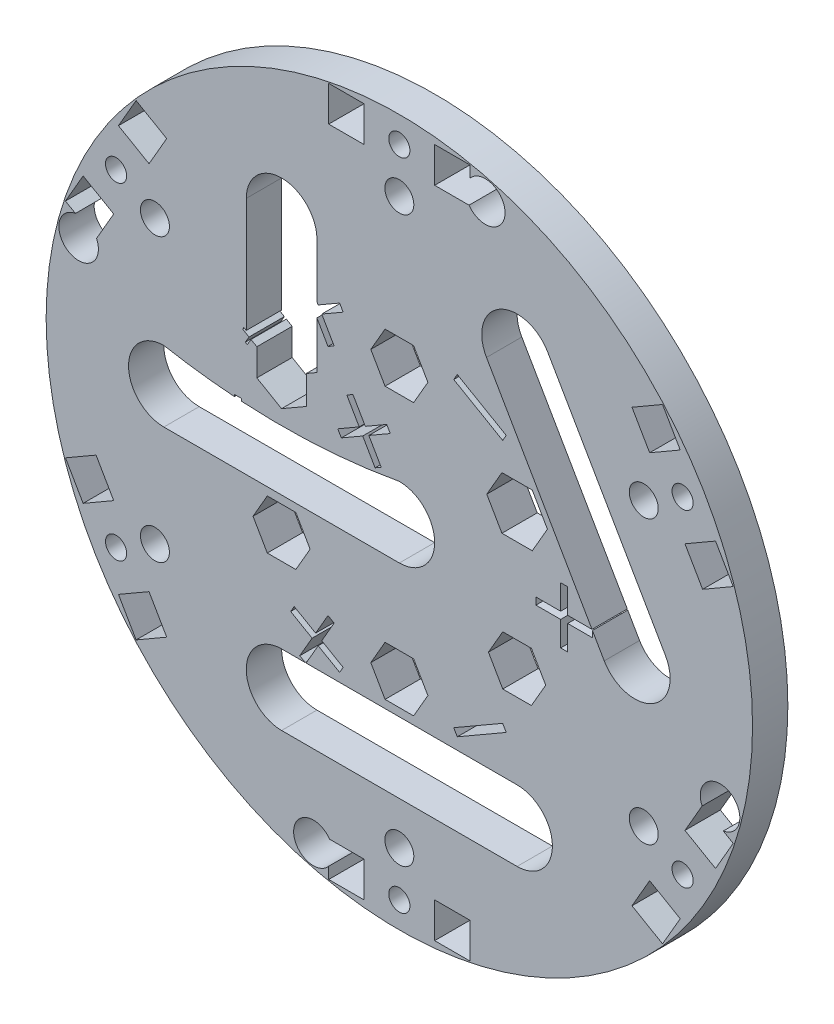
from build123d import *

# Parameters (mm, degrees)
ESQUISSE1_R        = 50
ESQUISSE1_W        = 5
ESQUISSE1_H        = 5
ESQUISSE1_R_2      = 1.5
ESQUISSE1_R_3      = 2.05
BOSS_EXTRU_1_DEPTH = 5
SKETCH3_W          = 1
SKETCH3_H          = 8
CUT_EXTRUDE2_DEPTH = 10
SKETCH4_R          = 2.8
CUT_EXTRUDE4_DEPTH = 10


with BuildPart() as part:
    # Esquisse1 → Boss.-Extru.1 (new body)
    with BuildSketch(Plane.XY):
        Circle(ESQUISSE1_R)
        Polygon((-39.762039705, -28.730127019), (-35.431912686, -26.230127019), (-32.931912686, -30.560254038), (-37.262039705, -33.060254038), align=None, mode=Mode.SUBTRACT)
        with Locations((-7.5, -46.3)):
            Rectangle(ESQUISSE1_W, ESQUISSE1_H, mode=Mode.SUBTRACT)
        with BuildLine():
            ThreePointArc((16.666666667, -23.867513459), (21.666666667, -28.867513459), (16.666666667, -33.867513459))
            Line((16.666666667, -33.867513459), (-16.666666667, -33.867513459))
            ThreePointArc((-16.666666667, -33.867513459), (-21.666666667, -28.867513459), (-16.666666667, -23.867513459))
            Line((-16.666666667, -23.867513459), (16.666666667, -23.867513459))
        make_face(mode=Mode.SUBTRACT)
        with Locations((-40.096976195, -23.15)):
            Circle(ESQUISSE1_R_2, mode=Mode.SUBTRACT)
        Polygon((-42.931912686, -13.239745962), (-40.431912686, -17.569872981), (-44.762039705, -20.069872981), (-47.262039705, -15.739745962), align=None, mode=Mode.SUBTRACT)
        with Locations((-34.597845014, -19.975075133)):
            Circle(ESQUISSE1_R_3, mode=Mode.SUBTRACT)
        Polygon((-14.65067109, -6.125235564), (-12.629945148, -9.625235564), (-14.65067109, -13.125235564), (-18.692122975, -13.125235564), (-20.712848917, -9.625235564), (-18.692122975, -6.125235564), align=None, mode=Mode.SUBTRACT)
        with Locations((0, -46.3)):
            Circle(ESQUISSE1_R_2, mode=Mode.SUBTRACT)
        with Locations((7.5, -46.3)):
            Rectangle(ESQUISSE1_W, ESQUISSE1_H, mode=Mode.SUBTRACT)
        with Locations((0, -39.950150265)):
            Circle(ESQUISSE1_R_3, mode=Mode.SUBTRACT)
        Polygon((32.931912686, -30.560254038), (35.431912686, -26.230127019), (39.762039705, -28.730127019), (37.262039705, -33.060254038), align=None, mode=Mode.SUBTRACT)
        Polygon((-2.020725942, -15.732757636), (2.020725942, -15.732757636), (4.041451884, -19.232757636), (2.020725942, -22.732757636), (-2.020725942, -22.732757636), (-4.041451884, -19.232757636), align=None, mode=Mode.SUBTRACT)
        Polygon((12.613362458, -9.622504487), (14.640014562, -6.112240073), (18.693318771, -6.112240073), (20.719970875, -9.622504487), (18.693318771, -13.132768901), (14.640014562, -13.132768901), align=None, mode=Mode.SUBTRACT)
        with Locations((34.597845014, -19.975075132)):
            Circle(ESQUISSE1_R_3, mode=Mode.SUBTRACT)
        with Locations((40.096976195, -23.15)):
            Circle(ESQUISSE1_R_2, mode=Mode.SUBTRACT)
        Polygon((44.762039705, -20.069872981), (40.431912686, -17.569872981), (42.931912686, -13.239745962), (47.262039705, -15.739745962), align=None, mode=Mode.SUBTRACT)
        Polygon((-44.762039705, 20.069872981), (-40.431912686, 17.569872981), (-42.931912686, 13.239745962), (-47.262039705, 15.739745962), align=None, mode=Mode.SUBTRACT)
        with Locations((-40.096976195, 23.15)):
            Circle(ESQUISSE1_R_2, mode=Mode.SUBTRACT)
        with Locations((-34.597845014, 19.975075133)):
            Circle(ESQUISSE1_R_3, mode=Mode.SUBTRACT)
        with BuildLine():
            Line((0, -5), (-33.333333333, -5))
            ThreePointArc((-33.333333333, -5), (-38.333333333, 0), (-33.333333333, 5))
            ThreePointArc((-33.333333333, 5), (-16.666666667, 3.481507562), (0, 5))
            ThreePointArc((0, 5), (5, 0), (0, -5))
        make_face(mode=Mode.SUBTRACT)
        with BuildLine():
            Line((-20.170900168, 11.646821857), (-21.670687629, 12.511577336))
            Line((-21.670687629, 12.511577336), (-21.666666516, 28.868742619))
            ThreePointArc((-21.666666516, 28.868742619), (-16.665437507, 33.867513308), (-11.666666818, 28.8662843))
            Line((-11.666666818, 28.8662843), (-11.670687326, 12.511578324))
            Line((-11.670687326, 12.511578324), (-13.170900379, 11.645101034))
            Line((-13.170900379, 11.645101034), (-13.171893897, 7.603649272))
            Line((-13.171893897, 7.603649272), (-16.67239055, 5.583783802))
            Line((-16.67239055, 5.583783802), (-20.171893686, 7.605370095))
            Line((-20.171893686, 7.605370095), (-20.170900168, 11.646821857))
        make_face(mode=Mode.SUBTRACT)
        Polygon((-32.931912686, 30.560254038), (-35.431912686, 26.230127019), (-39.762039705, 28.730127019), (-37.262039705, 33.060254038), align=None, mode=Mode.SUBTRACT)
        with Locations((0, 39.950150265)):
            Circle(ESQUISSE1_R_3, mode=Mode.SUBTRACT)
        with Locations((-7.5, 46.3)):
            Rectangle(ESQUISSE1_W, ESQUISSE1_H, mode=Mode.SUBTRACT)
        Polygon((18.816438469, 13.342663918), (20.963305142, 9.624181764), (18.816438469, 5.905699609), (14.522705123, 5.905699609), (12.37583845, 9.624181764), (14.522705123, 13.342663918), align=None, mode=Mode.SUBTRACT)
        Polygon((2.020725942, 22.665334425), (4.041451884, 19.165334425), (2.020725942, 15.665334425), (-2.020725942, 15.665334425), (-4.041451884, 19.165334425), (-2.020725942, 22.665334425), align=None, mode=Mode.SUBTRACT)
        with BuildLine():
            ThreePointArc((12.336539648, 26.367513459), (14.166666667, 33.197640478), (20.996793686, 31.367513459))
            Line((20.996793686, 31.367513459), (37.663460352, 2.5))
            ThreePointArc((37.663460352, 2.5), (35.833333333, -4.330127019), (29.003206314, -2.5))
            Line((29.003206314, -2.5), (12.336539648, 26.367513459))
        make_face(mode=Mode.SUBTRACT)
        with Locations((34.597845014, 19.975075133)):
            Circle(ESQUISSE1_R_3, mode=Mode.SUBTRACT)
        Polygon((42.931912686, 13.239745962), (40.431912686, 17.569872981), (44.762039705, 20.069872981), (47.262039705, 15.739745962), align=None, mode=Mode.SUBTRACT)
        with Locations((40.096976195, 23.15)):
            Circle(ESQUISSE1_R_2, mode=Mode.SUBTRACT)
        with Locations((0, 46.3)):
            Circle(ESQUISSE1_R_2, mode=Mode.SUBTRACT)
        with Locations((7.5, 46.3)):
            Rectangle(ESQUISSE1_W, ESQUISSE1_H, mode=Mode.SUBTRACT)
        Polygon((39.762039705, 28.730127019), (35.431912686, 26.230127019), (32.931912686, 30.560254038), (37.262039705, 33.060254038), align=None, mode=Mode.SUBTRACT)
    extrude(amount=BOSS_EXTRU_1_DEPTH)

    # Sketch3 → Cut-Extrude2 (cut)
    with BuildSketch(Plane.XY.offset(5)):
        with Locations((-22.833333333, 0)):
            Rectangle(SKETCH3_W, SKETCH3_H)
        Polygon((-13.233653965, 23.921361037), (-14.099679369, 23.421361037), (-12.349679369, 20.390272124), (-15.380768282, 18.640272124), (-14.880768282, 17.77424672), (-11.849679369, 19.52424672), (-10.099679369, 16.493157806), (-9.233653965, 16.993157806), (-10.983653965, 20.02424672), (-7.952565052, 21.77424672), (-8.452565052, 22.640272124), (-11.483653965, 20.890272124), align=None)
        Polygon((15.130768282, 18.207259422), (14.630768282, 17.341234018), (7.702565052, 21.341234018), (8.202565052, 22.207259422), align=None)
        Polygon((8.202565052, -22.207259422), (7.702565052, -21.341234018), (14.630768282, -17.341234018), (15.130768282, -18.207259422), align=None)
        Polygon((27.333333333, -0.5), (27.333333333, 0.5), (23.833333333, 0.5), (23.833333333, 4), (22.833333333, 4), (22.833333333, 0.5), (19.333333333, 0.5), (19.333333333, -0.5), (22.833333333, -0.5), (22.833333333, -4), (23.833333333, -4), (23.833333333, -0.5), align=None)
        Polygon((-14.099679369, -23.421361037), (-13.233653965, -23.921361037), (-11.483653965, -20.890272124), (-8.452565052, -22.640272124), (-7.952565052, -21.77424672), (-10.983653965, -20.02424672), (-9.233653965, -16.993157806), (-10.099679369, -16.493157806), (-11.849679369, -19.52424672), (-14.880768282, -17.77424672), (-15.380768282, -18.640272124), (-12.349679369, -20.390272124), align=None)
        Polygon((-7.433012703, 11.874355655), (-5.683012702, 8.843266741), (-8.714101616, 7.093266741), (-8.214101616, 6.227241337), (-5.183012702, 7.977241336), (-3.433012703, 4.946152425), (-2.566987299, 5.446152425), (-4.316987299, 8.477241337), (-1.285898385, 10.227241337), (-1.785898385, 11.093266741), (-4.816987299, 9.343266741), (-6.566987299, 12.374355655), align=None)
        Polygon((-20.834234776, 12.184801987), (-19.940304487, 11.668776346), (-20.102964744, 11.386925384), (-20.996895032, 11.902951025), (-21.517828526, 11.000607275), (-21.800380609, 11.163968654), (-21.279447115, 12.066312404), (-22.173377404, 12.582338045), (-22.010717147, 12.864189006), (-21.116786859, 12.348163365), (-20.596554487, 13.24840375), (-20.314002404, 13.085042371), align=None)
    extrude(amount=-CUT_EXTRUDE2_DEPTH, mode=Mode.SUBTRACT)

    # Sketch4 → Cut-Extrude4 (cut)
    with BuildSketch(Plane.XY.offset(5)):
        with Locations((-12.16449512, -45.398513836)):
            Circle(SKETCH4_R)
        with Locations((-45.398513836, 12.16449512)):
            Circle(SKETCH4_R)
        with Locations((12.16449512, 45.398513836)):
            Circle(SKETCH4_R)
        with Locations((45.398513836, -12.16449512)):
            Circle(SKETCH4_R)
    extrude(amount=-CUT_EXTRUDE4_DEPTH, mode=Mode.SUBTRACT)


solid = part.part
